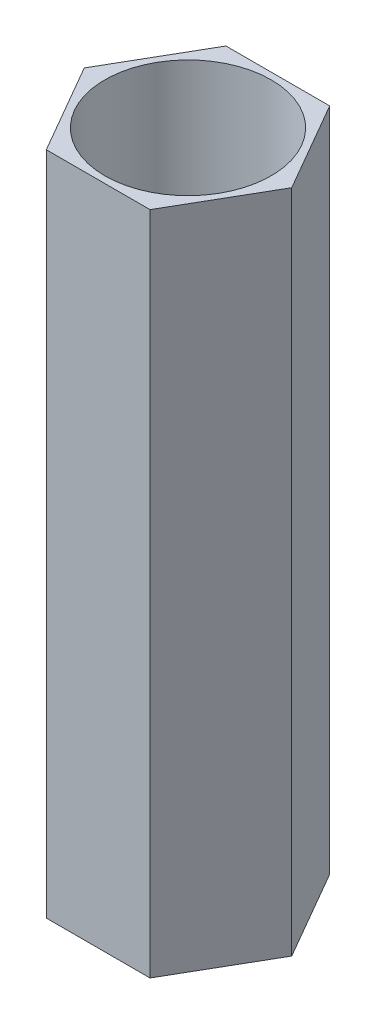
from build123d import *

# Parameters (mm, degrees)
SKETCH1_R           = 1.25
BOSS_EXTRUDE1_DEPTH = 10


with BuildPart() as part:
    # Sketch1 → Boss-Extrude1 (new body)
    with BuildSketch(Plane(origin=(0, 0, 0), x_dir=(1, 0, 0), z_dir=(0, 1, 0))):
        Polygon((0.779422863, -1.35), (1.558845727, 0), (0.779422863, 1.35), (-0.779422863, 1.35), (-1.558845727, 0), (-0.779422863, -1.35), align=None)
        with Locations(Location((0, 0, 0), (0, 0, 270))):
            Circle(SKETCH1_R, mode=Mode.SUBTRACT)
    extrude(amount=BOSS_EXTRUDE1_DEPTH)


solid = part.part
